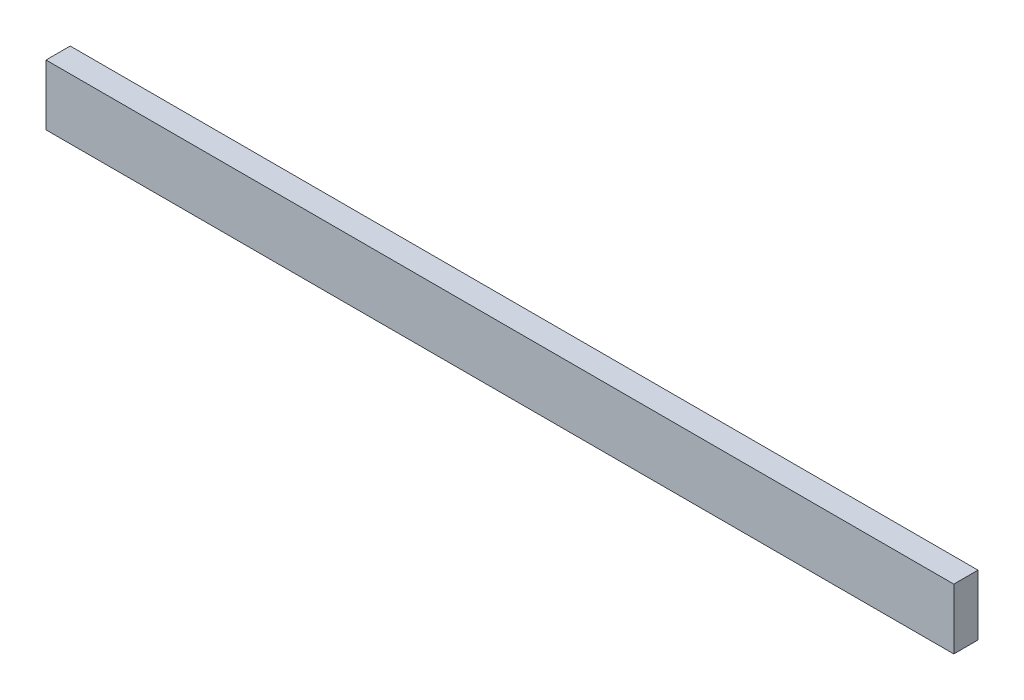
from build123d import *

# Parameters (mm, degrees)
CROQUIS1_W              = 150
CROQUIS1_H              = 10
SALIENTE_EXTRUIR1_DEPTH = 4


with BuildPart() as part:
    # Croquis1 → Saliente-Extruir1 (new body)
    with BuildSketch(Plane.XY):
        with Locations((75, 5)):
            Rectangle(CROQUIS1_W, CROQUIS1_H)
    extrude(amount=SALIENTE_EXTRUIR1_DEPTH)


solid = part.part
